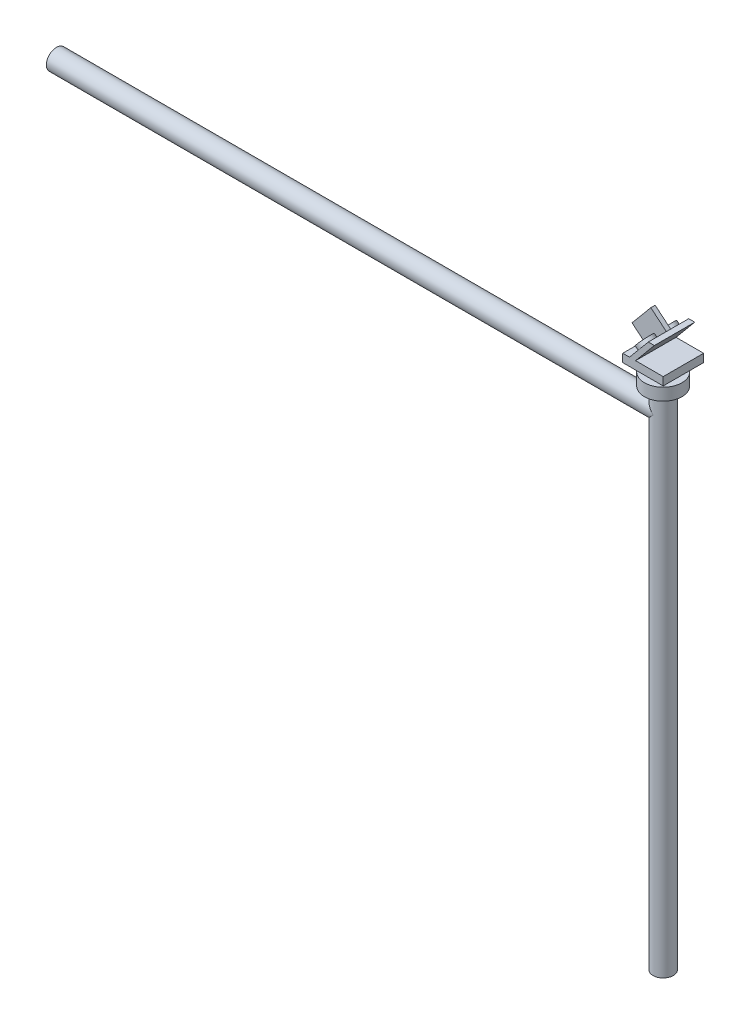
from build123d import *
from build123d.topology import SkipClean

# Parameters (mm, degrees)
SKETCH1_R           = 2.5
SKETCH3_R           = 2.5
BOSS_EXTRUDE1_DEPTH = 10
BOSS_EXTRUDE2_START = -2
SKETCH4_R           = 4.632532926
SKETCH4_R_2         = 2.5
BOSS_EXTRUDE2_DEPTH = 3
SKETCH5_W           = 10
SKETCH5_H           = 10
BOSS_EXTRUDE3_DEPTH = 2
BOSS_EXTRUDE4_DEPTH = 10
SKETCH7_W           = 1.069840708
SKETCH7_H           = 7.249028467
BOSS_EXTRUDE5_DEPTH = 5
SKETCH9_R           = 2
BOSS_EXTRUDE7_DEPTH = 1
SKETCH10_R          = 2
BOSS_EXTRUDE8_DEPTH = 1


with BuildPart() as part:
    # Sweep1: sweep along a path in Sketch2
    with BuildLine(Plane.XY) as sweep1_path:
        Line((0, 0), (0, 120))
        Line((0, 120), (-150, 120))
    # Sketch1 → Sweep1 (sweep)
    with BuildSketch(Plane(origin=(0, 0, 0), x_dir=(1, 0, 0), z_dir=(0, 1, 0))):
        Circle(SKETCH1_R)
    sweep(path=sweep1_path.line, transition=Transition.RIGHT)

    # Sketch3 → Boss-Extrude1 (add)
    with SkipClean():  # the faces are left unmerged after this step: merging them gives an invalid solid
        with BuildSketch(Plane(origin=(0, 130, 0), x_dir=(1, 0, 0), z_dir=(0, 1, 0))):
            with Locations(Location((0, 0, 0), (0, 0, 270))):
                Circle(SKETCH3_R)
        extrude(amount=-BOSS_EXTRUDE1_DEPTH)

    # Sketch5 → Boss-Extrude3 (add)
    with SkipClean():  # the faces are left unmerged after this step: merging them gives an invalid solid
        with BuildSketch(Plane(origin=(0, 130, 0), x_dir=(1, 0, 0), z_dir=(0, 1, 0))):
            Rectangle(SKETCH5_W, SKETCH5_H)
        extrude(amount=BOSS_EXTRUDE3_DEPTH)

    # Sketch6 → Boss-Extrude4 (add, through all)
    with SkipClean():  # the faces are left unmerged after this step: merging them gives an invalid solid
        with BuildSketch(Plane.XY.offset(5)):
            Polygon((-3.326842141, 132), (1.316524912, 137.566646758), (2.816524912, 137.566646758), (-1.826842141, 132), align=None)
        extrude(amount=-BOSS_EXTRUDE4_DEPTH)

    # Sketch7 → Boss-Extrude5 (add)
    with SkipClean():  # the faces are left unmerged after this step: merging them gives an invalid solid
        with BuildSketch(Plane(origin=(-66.891165059, 55.796648403, 0), x_dir=(0, 0, 1), z_dir=(-0.7679162502207892, 0.6405502577057027, 0))):
            with Locations((0, 102.858449672)):
                Rectangle(SKETCH7_W, SKETCH7_H)
        extrude(amount=BOSS_EXTRUDE5_DEPTH)


with BuildPart() as body_2:
    # Sketch4 → Boss-Extrude2 (new body)
    with BuildSketch(Plane(origin=(0, 130, 0), x_dir=(1, 0, 0), z_dir=(0, 1, 0)).offset(BOSS_EXTRUDE2_START)):
        with Locations(Location((0, 0, 0), (0, 0, 270))):
            Circle(SKETCH4_R)
        with Locations(Location((0, 0, 0), (0, 0, 270))):
            Circle(SKETCH4_R_2, mode=Mode.SUBTRACT)
    extrude(amount=-BOSS_EXTRUDE2_DEPTH)


with BuildPart() as body_3:
    # Sketch9 → Boss-Extrude7 (new body)
    with BuildSketch(Plane(origin=(-66.891165059, 55.796648403, 0), x_dir=(0, 0, 1), z_dir=(-0.7679162502207892, 0.6405502577057027, 0))):
        with Locations(Location((-2.767460177, 102.858449672, 0), (0, 0, 270))):
            Circle(SKETCH9_R)
    extrude(amount=BOSS_EXTRUDE7_DEPTH)


with BuildPart() as body_4:
    # Sketch10 → Boss-Extrude8 (new body)
    with BuildSketch(Plane(origin=(-66.891165059, 55.796648403, 0), x_dir=(0, 0, 1), z_dir=(-0.7679162502207892, 0.6405502577057027, 0))):
        with Locations(Location((2.767460177, 102.858449672, 0), (0, 0, 270))):
            Circle(SKETCH10_R)
    extrude(amount=BOSS_EXTRUDE8_DEPTH)


solid = Compound([part.part, body_2.part, body_3.part, body_4.part])
